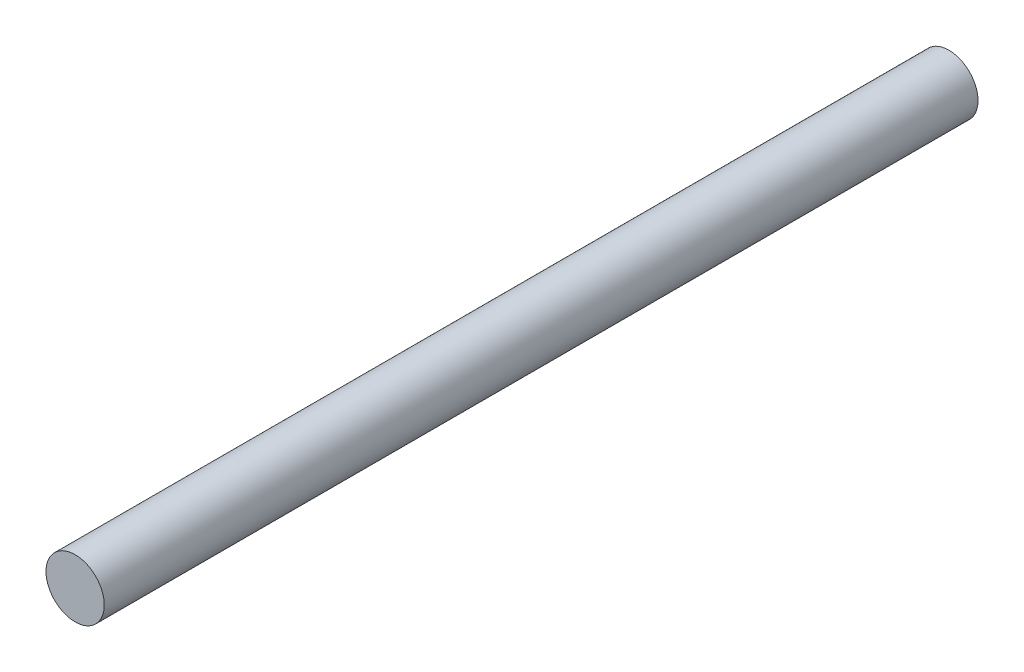
from build123d import *

# Parameters (mm, degrees)
SKETCH1_R           = 1.5
BOSS_EXTRUDE1_DEPTH = 45


with BuildPart() as part:
    # Sketch1 → Boss-Extrude1 (new body)
    with BuildSketch(Plane.XY):
        with Locations(Location((-1.001143765, 0.564120594, 0), (0, 0, 180))):
            Circle(SKETCH1_R)
    extrude(amount=BOSS_EXTRUDE1_DEPTH)


solid = part.part
